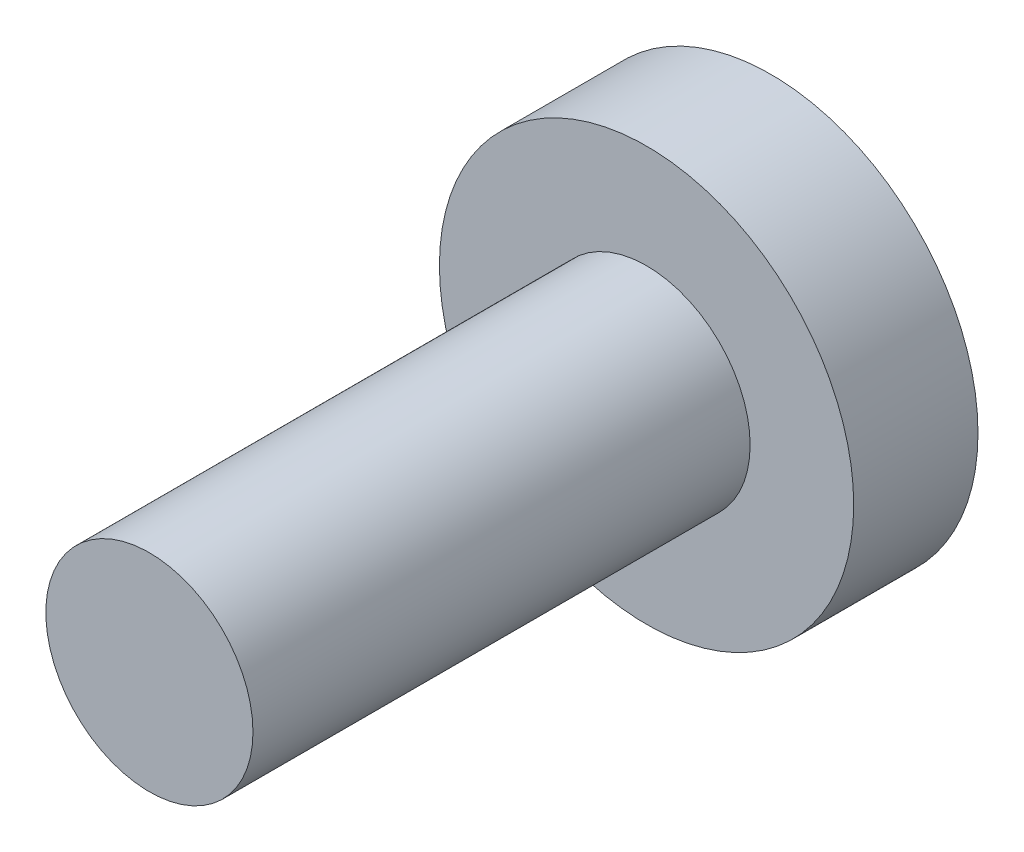
from build123d import *

# Parameters (mm, degrees)
SKETCH_1_R          = 1.25
EXTRUDE_1_DEPTH     = 6
SKETCH_2_R          = 2.5
EXTRUDE_2_DEPTH     = 1.5
CUT_EXTRUDE_1_DEPTH = 0.5


with BuildPart() as part:
    # 草图1 → 凸台-拉伸1 (new body)
    with BuildSketch(Plane.XY):
        Circle(SKETCH_1_R)
    extrude(amount=EXTRUDE_1_DEPTH)

    # 草图2 → 凸台-拉伸2 (add)
    with BuildSketch(Plane(origin=(0, 0, 0), x_dir=(-1, 0, 0), z_dir=(0, 0, -1))):
        Circle(SKETCH_2_R)
    extrude(amount=EXTRUDE_2_DEPTH)

    # 草图3 → 切除-拉伸1 (cut)
    with BuildSketch(Plane(origin=(0, 0, -1.5), x_dir=(-1, 0, 0), z_dir=(0, 0, -1))):
        Polygon((0.18, 1.25), (0.18, 0.18), (1.25, 0.18), (1.25, -0.18), (0.18, -0.18), (0.18, -1.25), (-0.18, -1.25), (-0.18, -0.18), (-1.25, -0.18), (-1.25, 0.18), (-0.18, 0.18), (-0.18, 1.25), align=None)
    extrude(amount=-CUT_EXTRUDE_1_DEPTH, mode=Mode.SUBTRACT)


solid = part.part
